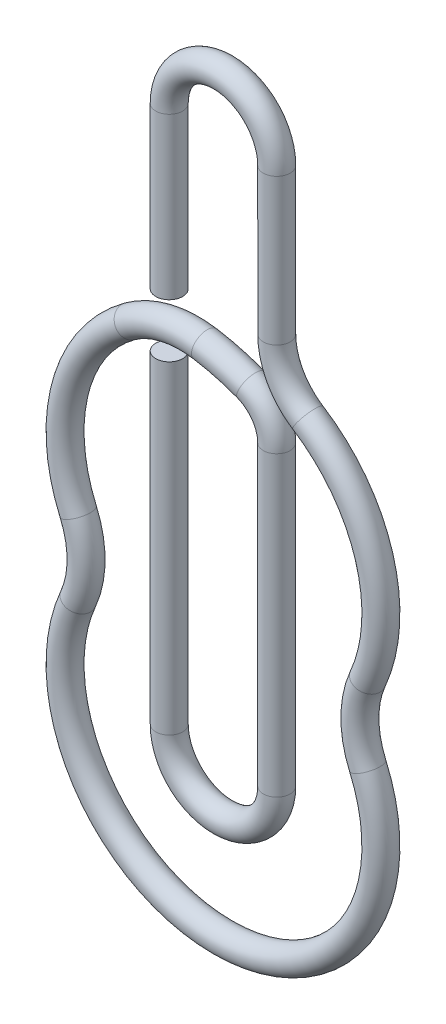
from build123d import *

# Parameters (mm, degrees)
SKETCH_4_R = 2


with BuildPart() as part:
    # По траектории2: sweep along a path in Эскиз3
    with BuildLine(Plane.XY) as sweep_2_path:
        Line((-8, 33.096379794), (-8, -15))
        ThreePointArc((-8, -15), (0, -23), (8, -15))
        Line((8, -15), (8, 29.249773455))
        ThreePointArc((8, 29.249773455), (6.942526826, 32.651453712), (4.142857143, 34.854072097))
        ThreePointArc((4.142857143, 34.854072097), (0.787006514, 35.941295938), (-2.663432053, 36.674959909))
        ThreePointArc((-2.663432053, 36.674959909), (-8.538573381, 36.44183229), (-13.872741909, 33.968316529))
        ThreePointArc((-13.872741909, 33.968316529), (-22.686391933, 21.130058814), (-21.538105766, 5.6))
        ThreePointArc((-21.538105766, 5.6), (-20.369317712, 0), (-21.538105766, -5.6))
        ThreePointArc((-21.538105766, -5.6), (0, -38.5), (21.538105766, -5.6))
        ThreePointArc((21.538105766, -5.6), (20.369317712, 0), (21.538105766, 5.6))
        ThreePointArc((21.538105766, 5.6), (22.477900182, 21.85521724), (12.626865672, 34.819492004))
        ThreePointArc((12.626865672, 34.819492004), (9.232693022, 38.443502555), (8, 43.253318389))
        Line((8, 43.253318389), (8, 65))
        ThreePointArc((8, 65), (0, 73), (-8, 65))
        Line((-8, 65), (-8, 41.096379794))
    # Эскиз4 → По траектории2 (sweep)
    with BuildSketch(Plane(origin=(-8, 41.096379794, 0), x_dir=(-1, 0, 0), z_dir=(0, -1, 0))):
        Circle(SKETCH_4_R)
    sweep(path=sweep_2_path.line)


solid = part.part
